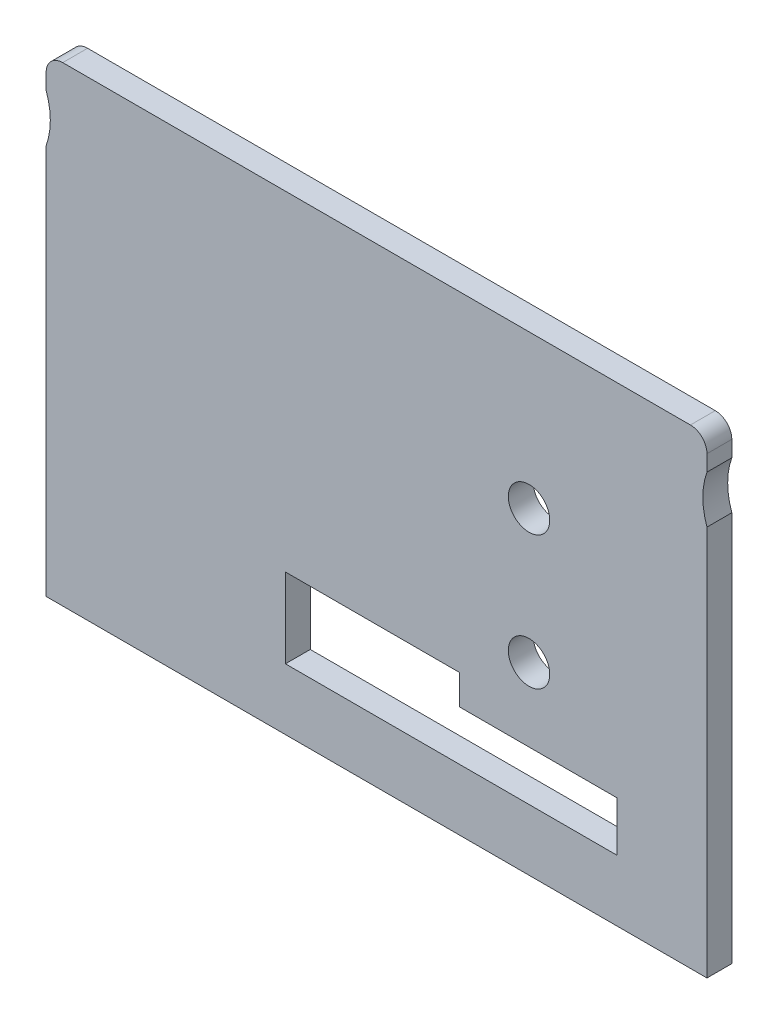
from build123d import *

# Parameters (mm, degrees)
SKETCH2_W           = 80
SKETCH2_H           = 56.8
SKETCH2_R           = 2.5
BOSS_EXTRUDE1_DEPTH = 3
SKETCH4_W           = 0.125
SKETCH4_H           = 56.8
CUT_EXTRUDE2_DEPTH  = 99.159258351
SKETCH3_R           = 8.5
CUT_EXTRUDE1_DEPTH  = 99.057409842
FILLET1_R           = 2


with BuildPart() as part:
    # Sketch2 → Boss-Extrude1 (new body)
    with BuildSketch(Plane.XY):
        with Locations((40, 28.4)):
            Rectangle(SKETCH2_W, SKETCH2_H)
        with Locations((58.4, 38.35)):
            Circle(SKETCH2_R, mode=Mode.SUBTRACT)
        with Locations((58.4, 22.25)):
            Circle(SKETCH2_R, mode=Mode.SUBTRACT)
        Polygon((29, 7.4), (29, 17), (50, 17), (50, 13.4), (69, 13.4), (69, 7.4), align=None, mode=Mode.SUBTRACT)
    extrude(amount=BOSS_EXTRUDE1_DEPTH)

    # Sketch4 → Cut-Extrude2 (cut, through all)
    with BuildSketch(Plane.XY.offset(3)):
        with Locations((0.0625, 28.4)):
            Rectangle(SKETCH4_W, SKETCH4_H)
        with Locations((79.9375, 28.4)):
            Rectangle(SKETCH4_W, SKETCH4_H)
    extrude(amount=-CUT_EXTRUDE2_DEPTH, mode=Mode.SUBTRACT)

    # Sketch3 → Cut-Extrude1 (cut, through all)
    with BuildSketch(Plane.XY.offset(3)):
        with Locations((-7.875, 50)):
            Circle(SKETCH3_R)
        with Locations((87.875, 50)):
            Circle(SKETCH3_R)
    extrude(amount=-CUT_EXTRUDE1_DEPTH, mode=Mode.SUBTRACT)

    # Fillet1
    fillet1_edges = [part.edges().sort_by_distance(p)[0] for p in [
        (0.125, 56.8, 1.5),
        (79.875, 56.8, 1.5),
    ]]
    fillet(fillet1_edges, radius=FILLET1_R)


solid = part.part
